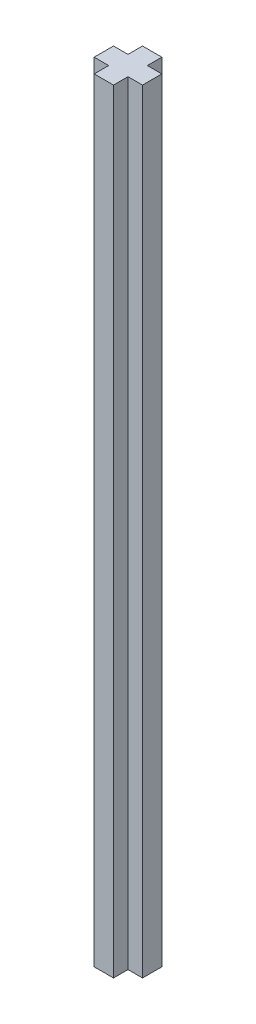
from build123d import *

# Parameters (mm, degrees)
EXTRUDE_1_DEPTH = 80


with BuildPart() as part:
    # 草图1 → 凸台-拉伸1 (new body)
    with BuildSketch(Plane(origin=(0, 0, 0), x_dir=(1, 0, 0), z_dir=(0, 1, 0))):
        Polygon((1, 1), (2.5, 1), (2.5, -1), (1, -1), (1, -2.5), (-1, -2.5), (-1, -1), (-2.5, -1), (-2.5, 1), (-1, 1), (-1, 2.5), (1, 2.5), align=None)
    extrude(amount=EXTRUDE_1_DEPTH)


solid = part.part
